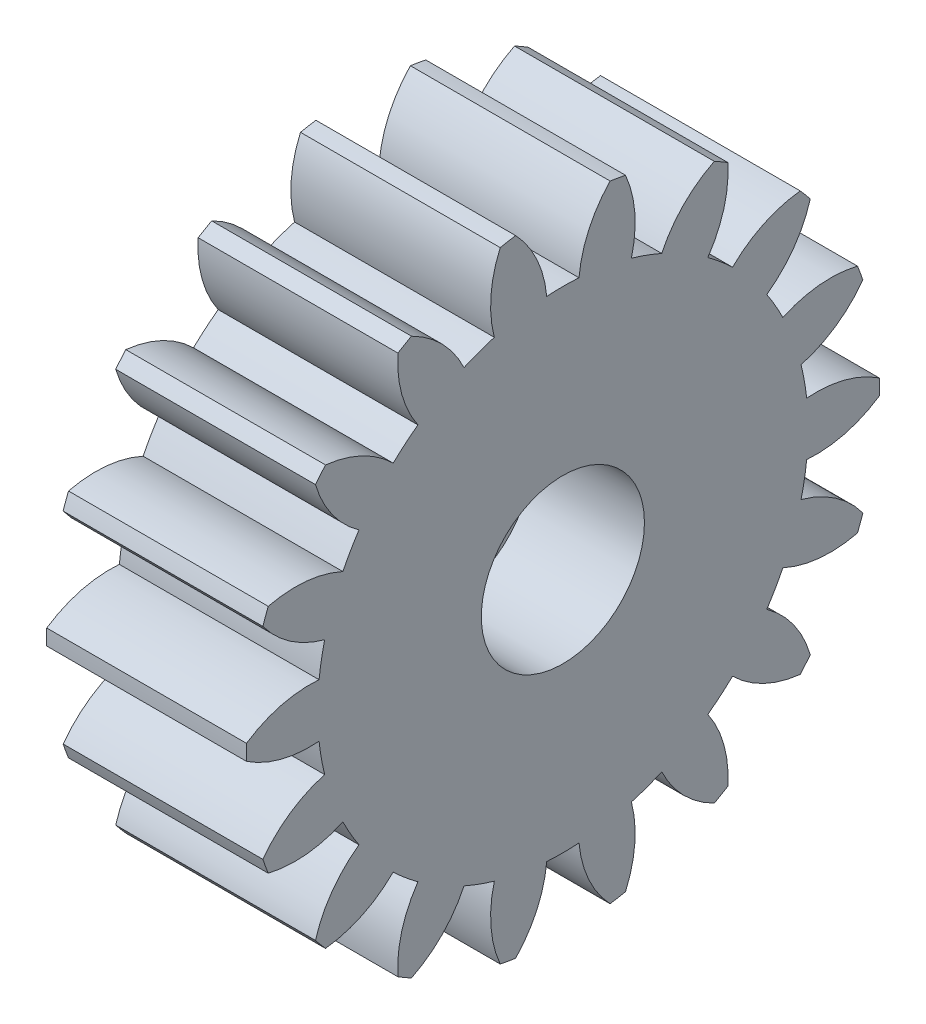
from build123d import *

# Parameters (mm, degrees)
BASPROSKE_W        = 7.1
BASPROSKE_H        = 11.25
TOOTHCUT_DEPTH     = 18.422255881
TEETHCUTS_COUNT    = 18
TEETHCUTS_ANGLE    = 340
BORSKE_R           = 1.5
BORE_DEPTH         = 50.0000508
SKETCH1_R          = 2.9
CUT_EXTRUDE1_DEPTH = 4


with BuildPart() as part:
    # BasProSke → Base-Revolve (revolve)
    with BuildSketch(Plane(origin=(0, 0, 0), x_dir=(1, 0, 0), z_dir=(0, 1, 0)), mode=Mode.PRIVATE) as base_revolve_sk:
        with Locations((3.55, 5.625)):
            Rectangle(BASPROSKE_W, BASPROSKE_H)
    revolve(base_revolve_sk.sketch.rotate(Axis((-10, 0, 0), (1, 0, 0)), 180), axis=Axis((-10, 0, 0), (1, 0, 0)))

    # TooCutSke → ToothCut (cut, through all)
    with BuildSketch(Plane(origin=(0, 0, 0), x_dir=(0, 0, -1), z_dir=(1, 0, 0))):
        with BuildLine():
            ThreePointArc((0.573352044, 8.698875358), (0, 8.71775), (-0.573352044, 8.698875358))
            ThreePointArc((-0.573352044, 8.698875358), (-0.927373593, 10.019142299), (-1.700441513, 11.146440859))
            ThreePointArc((-1.700441513, 11.146440859), (0, 11.2754), (1.700441513, 11.146440859))
            ThreePointArc((1.700441513, 11.146440859), (0.927373593, 10.019142299), (0.573352044, 8.698875358))
        make_face()
    toothcut = extrude(amount=TOOTHCUT_DEPTH, mode=Mode.SUBTRACT)

    # TeethCuts: ToothCut ×18 about axis
    teethcuts_axis = Axis((-10, 0, 0), (1, 0, 0))
    for i in range(1, TEETHCUTS_COUNT):
        add(toothcut.rotate(teethcuts_axis, i * TEETHCUTS_ANGLE / (TEETHCUTS_COUNT - 1)), mode=Mode.SUBTRACT)

    # BorSke → Bore (cut, symmetric)
    with BuildSketch(Plane(origin=(0, 0, 0), x_dir=(0, 0, -1), z_dir=(1, 0, 0))):
        with Locations(Location((0, 0, 0), (0, 0, 180))):
            Circle(BORSKE_R)
    extrude(amount=BORE_DEPTH, both=True, mode=Mode.SUBTRACT)

    # Sketch1 → Cut-Extrude1 (cut)
    with BuildSketch(Plane(origin=(7.1, 0, 0), x_dir=(0, 0, -1), z_dir=(1, 0, 0))):
        Circle(SKETCH1_R)
    extrude(amount=-CUT_EXTRUDE1_DEPTH, mode=Mode.SUBTRACT)


solid = part.part
